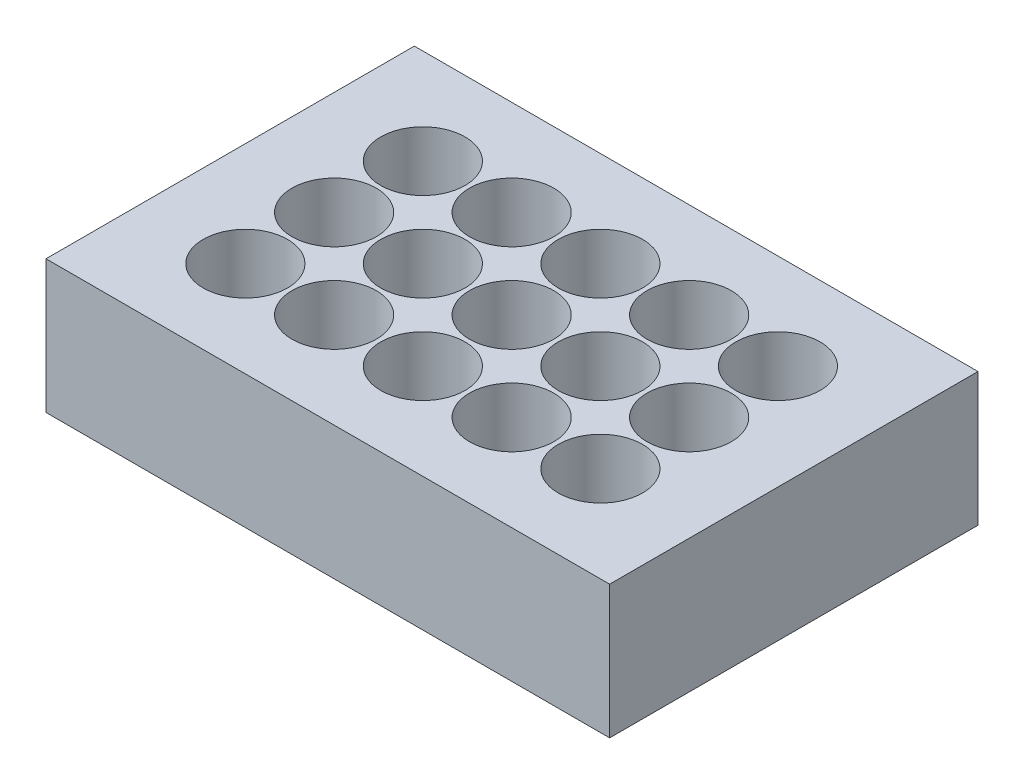
from build123d import *

# Parameters (mm, degrees)
SKETCH4_W            = 127
SKETCH4_H            = 83
BOSS_EXTRUDE3_DEPTH  = 30
SKETCH10_R           = 9.5
CUT_EXTRUDE11_DEPTH  = 80.871772235
SKETCH8_R            = 2.5
CUT_EXTRUDE9_DEPTH   = 3.7
SKETCH8_11_R         = 2.2352
CUT_EXTRUDE10_DEPTH  = 82.575118756
CUT_EXTRUDE12_START  = -82.575118756
SKETCH8_12_R         = 4.0132
SKETCH8_12_R_2       = 2.2352
CUT_EXTRUDE12_DEPTH  = 83.641918756
LPATTERN4_COUNT      = 6
LPATTERN4_PITCH      = 20
LPATTERN4_COUNT_DIR2 = 4
LPATTERN4_PITCH_DIR2 = 20
SKETCH8_13_R         = 6.4008
SKETCH8_13_R_2       = 4.6228
CUT_EXTRUDE16_DEPTH  = 1.3208
LPATTERN5_COUNT      = 5
LPATTERN5_PITCH      = 20
LPATTERN5_COUNT_DIR2 = 3
LPATTERN5_PITCH_DIR2 = 20


with BuildPart() as part:
    # Sketch4 → Boss-Extrude3 (new body)
    with BuildSketch(Plane(origin=(0, 10, 0), x_dir=(1, 0, 0), z_dir=(0, 1, 0))):
        Rectangle(SKETCH4_W, SKETCH4_H)
    extrude(amount=BOSS_EXTRUDE3_DEPTH)

    # Sketch10 → Cut-Extrude11 (cut, through all)
    with BuildSketch(Plane(origin=(0, 15, 0), x_dir=(1, 0, 0), z_dir=(0, 1, 0))):
        with Locations((-40.08, -20)):
            Circle(SKETCH10_R)
    cut_extrude11 = extrude(amount=CUT_EXTRUDE11_DEPTH, mode=Mode.SUBTRACT)

    # Sketch8 → Cut-Extrude9 (cut)
    with BuildSketch(Plane(origin=(0, 10, 0), x_dir=(1, 0, 0), z_dir=(0, 1, 0))):
        with Locations((-50.08, -30)):
            Circle(SKETCH8_R)
    cut_extrude9 = extrude(amount=CUT_EXTRUDE9_DEPTH, mode=Mode.SUBTRACT)

    # Sketch8<11> → Cut-Extrude10 (cut, through all)
    with BuildSketch(Plane(origin=(0, 10, 0), x_dir=(1, 0, 0), z_dir=(0, 1, 0))):
        with Locations((-40.08, -20)):
            Circle(SKETCH8_11_R)
    cut_extrude10 = extrude(amount=CUT_EXTRUDE10_DEPTH, mode=Mode.SUBTRACT)

    # Sketch8<12> → Cut-Extrude12 (cut)
    with BuildSketch(Plane(origin=(0, 10, 0), x_dir=(1, 0, 0), z_dir=(0, 1, 0)).offset(CUT_EXTRUDE12_START)):
        with Locations((-40.08, -20)):
            Circle(SKETCH8_12_R)
        with Locations((-40.08, -20)):
            Circle(SKETCH8_12_R_2, mode=Mode.SUBTRACT)
    cut_extrude12 = extrude(amount=CUT_EXTRUDE12_DEPTH, mode=Mode.SUBTRACT)

    # LPattern4: Cut-Extrude9 6 × 4
    with Locations(*[(i * LPATTERN4_PITCH, 0, -j * LPATTERN4_PITCH_DIR2) for i in range(LPATTERN4_COUNT) for j in range(LPATTERN4_COUNT_DIR2) if (i, j) != (0, 0)]):
        add(cut_extrude9, mode=Mode.SUBTRACT)

    # Sketch8<13> → Cut-Extrude16 (cut)
    with BuildSketch(Plane(origin=(0, 10, 0), x_dir=(1, 0, 0), z_dir=(0, 1, 0))):
        with Locations((-40.08, -20)):
            Circle(SKETCH8_13_R)
        with Locations((-40.08, -20)):
            Circle(SKETCH8_13_R_2, mode=Mode.SUBTRACT)
    cut_extrude16 = extrude(amount=CUT_EXTRUDE16_DEPTH, mode=Mode.SUBTRACT)

    # LPattern5: Cut-Extrude11, Cut-Extrude10, Cut-Extrude12, Cut-Extrude16 5 × 3
    with Locations(*[(i * LPATTERN5_PITCH, 0, -j * LPATTERN5_PITCH_DIR2) for i in range(LPATTERN5_COUNT) for j in range(LPATTERN5_COUNT_DIR2) if (i, j) != (0, 0)]):
        add(cut_extrude11, mode=Mode.SUBTRACT)
        add(cut_extrude10, mode=Mode.SUBTRACT)
        add(cut_extrude12, mode=Mode.SUBTRACT)
        add(cut_extrude16, mode=Mode.SUBTRACT)


solid = part.part
